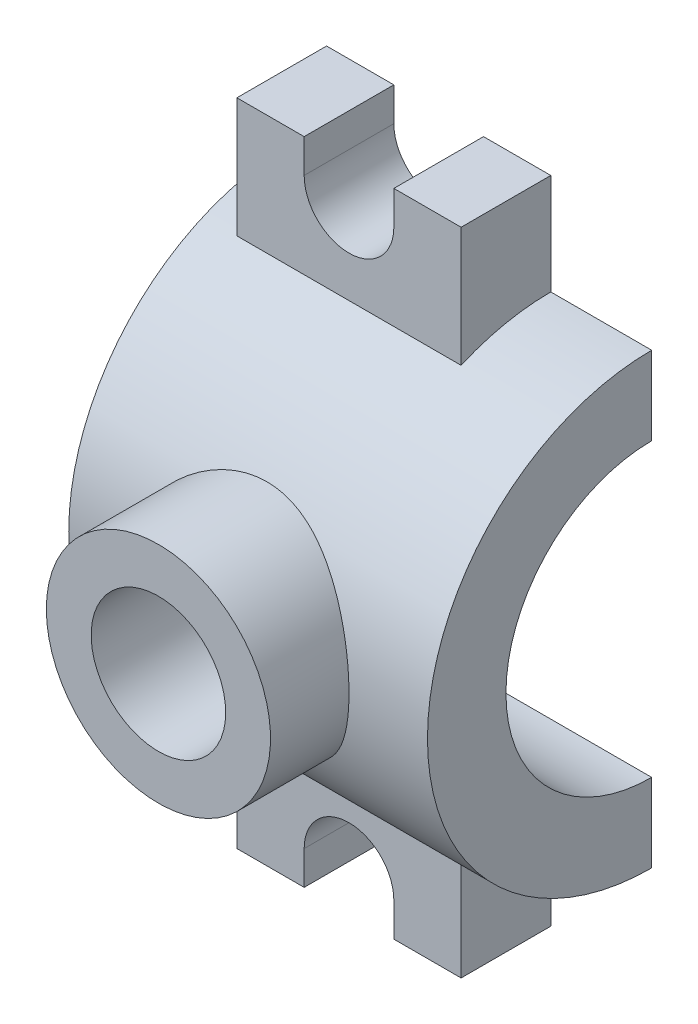
from build123d import *

# Parameters (mm, degrees)
EXTRUDE_1_DEPTH     = 32
SKETCH_2_R          = 10
EXTRUDE_2_DEPTH     = 27
SKETCH_3_W          = 20
SKETCH_3_H          = 58
EXTRUDE_3_DEPTH     = 8
SKETCH_4_R          = 6
CUT_EXTRUDE_1_DEPTH = 51.931326429
CUT_EXTRUDE_2_DEPTH = 51.931326429
CUT_EXTRUDE_4_DEPTH = 8


with BuildPart() as part:
    # 草图1 → 凸台-拉伸1 (new body)
    with BuildSketch(Plane(origin=(0, 0, 0), x_dir=(0, 0, -1), z_dir=(1, 0, 0))):
        with BuildLine():
            Line((0, 20), (0, -20))
            ThreePointArc((0, -20), (-20, 0), (0, 20))
        make_face()
    extrude(amount=EXTRUDE_1_DEPTH)

    # 草图2 → 凸台-拉伸2 (add)
    with BuildSketch(Plane(origin=(0, 0, 0), x_dir=(-1, 0, 0), z_dir=(0, 0, -1))):
        with Locations((-15, 0)):
            Circle(SKETCH_2_R)
    extrude(amount=-EXTRUDE_2_DEPTH)

    # 草图3 → 凸台-拉伸3 (add)
    with BuildSketch(Plane(origin=(0, 0, 0), x_dir=(-1, 0, 0), z_dir=(0, 0, -1))):
        with Locations((-13, 0)):
            Rectangle(SKETCH_3_W, SKETCH_3_H)
    extrude(amount=-EXTRUDE_3_DEPTH)

    # 草图4 → 切除-拉伸1 (cut, through all)
    with BuildSketch(Plane.XY.offset(27)):
        with Locations((15, 0)):
            Circle(SKETCH_4_R)
    extrude(amount=-CUT_EXTRUDE_1_DEPTH, mode=Mode.SUBTRACT)

    # 草图5 → 切除-拉伸2 (cut, through all)
    with BuildSketch(Plane(origin=(32, 0, 0), x_dir=(0, 0, -1), z_dir=(1, 0, 0))):
        with BuildLine():
            Line((0, 13), (0, -13))
            ThreePointArc((0, -13), (-13, 0), (0, 13))
        make_face()
    extrude(amount=-CUT_EXTRUDE_2_DEPTH, mode=Mode.SUBTRACT)

    # 草图6 → 切除-拉伸4 (cut)
    with BuildSketch(Plane(origin=(0, 0, 0), x_dir=(-1, 0, 0), z_dir=(0, 0, -1))):
        with BuildLine():
            Line((-17, 26), (-17, 29))
            Line((-17, 29), (-9, 29))
            Line((-9, 29), (-9, 26))
            ThreePointArc((-9, 26), (-13, 22), (-17, 26))
        make_face()
        with BuildLine():
            Line((-17, -26), (-17, -29))
            Line((-17, -29), (-9, -29))
            Line((-9, -29), (-9, -26))
            ThreePointArc((-9, -26), (-13, -22), (-17, -26))
        make_face()
    extrude(amount=-CUT_EXTRUDE_4_DEPTH, mode=Mode.SUBTRACT)


solid = part.part
